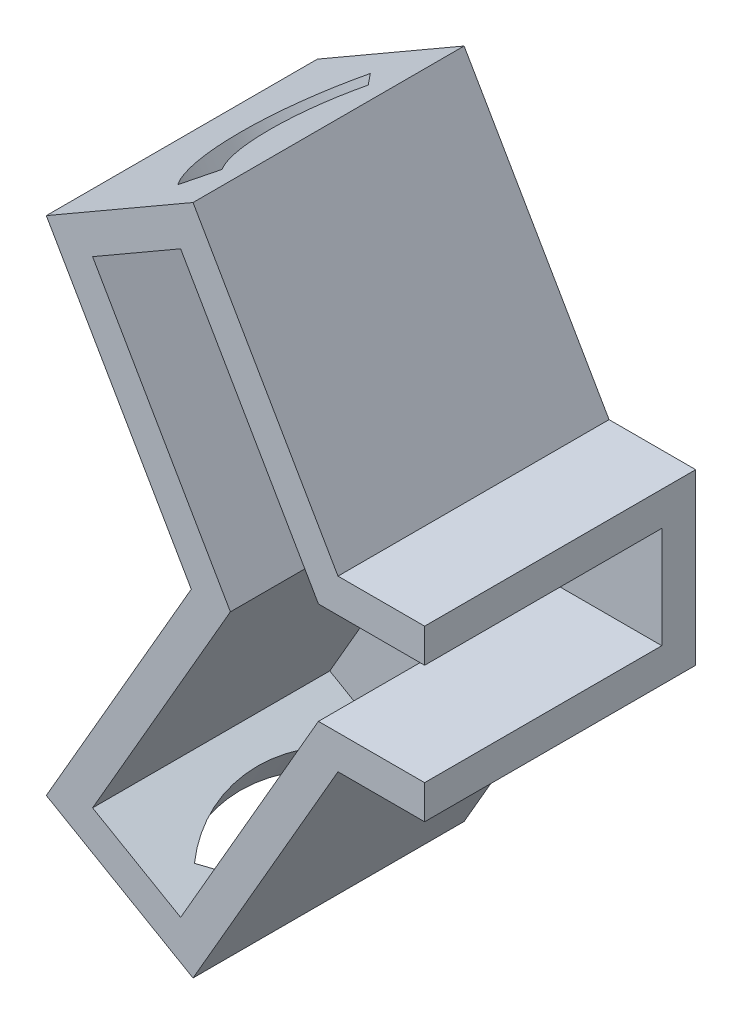
from build123d import *

# Parameters (mm, degrees)
EXTRUDE_THIN1_DEPTH     = 8
SHELL4_T                = -1
CUT_EXTRUDE_THIN1_DEPTH = 8


with BuildPart() as part:
    # Sketch1 → Extrude-Thin1 (new body)
    with BuildSketch(Plane(origin=(0, 0, 0), x_dir=(0, 1, 0), z_dir=(0, 0, 1))):
        Polygon((2.5, 0), (2.5, 2.556624327), (9.910254038, 6.834936491), (7.410254038, 11.165063509), (-2.5, 5.443375673), (-2.5, 0), align=None)
    extrude_thin1 = extrude(amount=EXTRUDE_THIN1_DEPTH)

    # Mirror3: Extrude-Thin1 across plane
    add(extrude_thin1.mirror(Plane.ZX))

    # Shell4
    shell4_openings = [part.faces().sort_by_distance(p)[0] for p in [
        (-5.923522884, 0, 8),
        (0, 0, 4),
    ]]
    offset(amount=SHELL4_T, openings=shell4_openings, kind=Kind.INTERSECTION)

    # Sketch5 → Cut-Extrude-Thin1 (cut)
    with BuildSketch(Plane(origin=(-6, 10.392304845, 0), x_dir=(-0.8660254037844398, -0.49999999999999806, 0), z_dir=(-0.499999999999998, 0.8660254037844397, 0))):
        with BuildLine():
            ThreePointArc((2.10203265, 6.155172414), (2.964101615, 4), (2.10203265, 1.844827586))
            Line((2.10203265, 1.844827586), (2.826170581, 1.155172414))
            ThreePointArc((2.826170581, 1.155172414), (3.964101615, 4), (2.826170581, 6.844827586))
            Line((2.826170581, 6.844827586), (2.10203265, 6.155172414))
        make_face()
    cut_extrude_thin1 = extrude(amount=-CUT_EXTRUDE_THIN1_DEPTH, mode=Mode.SUBTRACT)

    # Mirror4: Cut-Extrude-Thin1 across plane
    add(cut_extrude_thin1.mirror(Plane.ZX), mode=Mode.SUBTRACT)


solid = part.part
